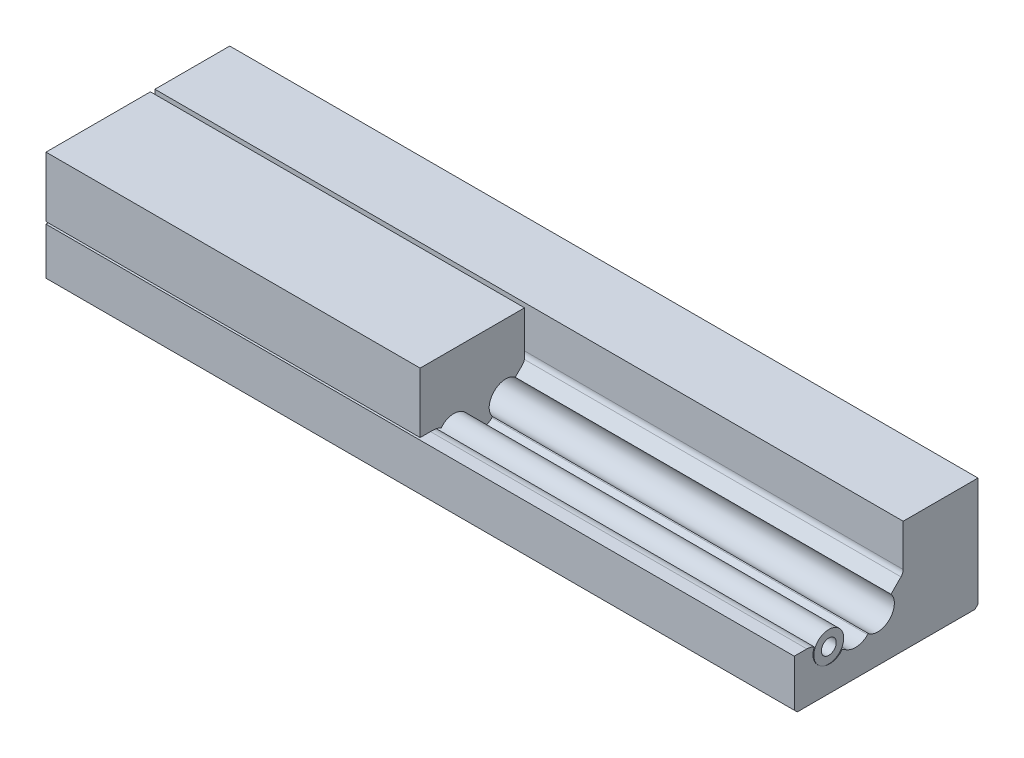
from build123d import *

# Parameters (mm, degrees)
BOSS_EXTRUDE1_DEPTH = 100
BOSS_EXTRUDE2_DEPTH = 50
SKETCH1_4_R         = 2
SKETCH1_4_R_2       = 1
BOSS_EXTRUDE3_DEPTH = 100


with BuildPart() as part:
    # Sketch1 → Boss-Extrude1 (new body)
    with BuildSketch(Plane.YZ):
        with BuildLine():
            Line((-14.6, 0), (0, 0))
            Line((0, 0), (0, 10))
            Line((0, 10), (-5.585786438, 10))
            ThreePointArc((-5.585786438, 10), (-5.96846987, 10.076120467), (-6.292893219, 10.292893219))
            Line((-6.292893219, 10.292893219), (-7.630448846, 11.630448846))
            add(Edge.make_bspline(
                [(-10.662444373, 14.662444373), (-11.864824632, 13.248529542), (-10.454594155, 11.838299064), (-9.044363677, 10.428068587), (-7.630448846, 11.630448846)],
                knots=[0.075070491, 0.075070491, 0.075070491, 1.570796327, 1.570796327, 3.066522163, 3.066522163, 3.066522163], degree=2, weights=[1, 0.733143915, 1, 0.733143915, 1]))
            Line((-10.662444373, 14.662444373), (-10.752061132, 14.752061132))
            Line((-10.752061132, 14.752061132), (-12, 16))
            Line((-12, 16), (-11.117573964, 17.528406729))
            Line((-11.117573964, 17.528406729), (-10.75254502, 18.160655405))
            add(Edge.make_bspline(
                [(-11.282719811, 20.942365731), (-12.279903121, 19.215193255), (-10.75254502, 18.160655405)],
                knots=[1.570796412, 1.570796412, 1.570796412, 3.066522163, 3.066522163, 3.066522163], degree=2, weights=[1, 0.733143944, 1]))
            add(Edge.make_bspline(
                [(-8.608600423, 21.874076377), (-10.285536329, 22.669538504), (-11.282719811, 20.942365731)],
                knots=[0.075070491, 0.075070491, 0.075070491, 1.570796412, 1.570796412, 1.570796412], degree=2, weights=[1, 0.733143886, 1]))
            ThreePointArc((-8.608600423, 21.874076377), (-8.408799578, 22.356438286), (-8.34065123, 22.874076377))
            Line((-8.34065123, 22.874076377), (-8.34065123, 24.555864176))
            Line((-8.34065123, 24.555864176), (-14.6, 24.555864176))
            Line((-14.6, 24.555864176), (-15, 24.155864176))
            Line((-15, 24.155864176), (-15, 0.4))
            Line((-15, 0.4), (-14.6, 0))
        make_face()
        with BuildLine():
            Line((-12, 16), (-10.752061132, 14.752061132))
            ThreePointArc((-10.752061132, 14.752061132), (-11.406038716, 16.078196486), (-11.117573964, 17.528406729))
            Line((-11.117573964, 17.528406729), (-12, 16))
        make_face()
    extrude(amount=BOSS_EXTRUDE1_DEPTH)


with BuildPart() as body_2:
    # Sketch1<3> → Boss-Extrude2 (new body)
    with BuildSketch(Plane.YZ):
        with BuildLine():
            add(Edge.make_bspline(
                [(-7.418316812, 11.84258088), (-6.215936552, 13.256495711), (-7.62616703, 14.666726189), (-9.036397507, 16.076956667), (-10.450312338, 14.874576407)],
                knots=[3.216663145, 3.216663145, 3.216663145, 4.71238898, 4.71238898, 6.208114816, 6.208114816, 6.208114816], degree=2, weights=[1, 0.733143915, 1, 0.733143915, 1]))
            Line((-7.418316812, 11.84258088), (-6.46862915, 10.892893219))
            ThreePointArc((-6.46862915, 10.892893219), (-6.144205801, 10.676120467), (-5.761522369, 10.6))
            Line((-5.761522369, 10.6), (0, 10.6))
            Line((0, 10.6), (0, 24.555864176))
            Line((0, 24.555864176), (-7.060269515, 24.555864176))
            Line((-7.060269515, 24.555864176), (-8.04065123, 24.555864176))
            Line((-8.04065123, 24.555864176), (-8.04065123, 22.874076377))
            ThreePointArc((-8.04065123, 22.874076377), (-8.11902183, 22.278792573), (-8.348792802, 21.724076377))
            add(Edge.make_bspline(
                [(-7.818617405, 18.9423671), (-6.821435564, 20.669539122), (-8.348792802, 21.724076377)],
                knots=[4.71238963, 4.71238963, 4.71238963, 6.208114816, 6.208114816, 6.208114816], degree=2, weights=[1, 0.733144136, 1]))
            add(Edge.make_bspline(
                [(-10.492737399, 18.010655405), (-8.815800545, 17.215192828), (-7.818617405, 18.9423671)],
                knots=[3.216663145, 3.216663145, 3.216663145, 4.71238963, 4.71238963, 4.71238963], degree=2, weights=[1, 0.733143694, 1]))
            Line((-10.492737399, 18.010655405), (-10.857766343, 17.378406729))
            ThreePointArc((-10.857766343, 17.378406729), (-11.108605258, 16.117354344), (-10.539929097, 14.964193166))
            Line((-10.539929097, 14.964193166), (-10.450312338, 14.874576407))
        make_face()
    extrude(amount=BOSS_EXTRUDE2_DEPTH)


with BuildPart() as body_3:
    # Sketch1<4> → Boss-Extrude3 (new body)
    with BuildSketch(Plane.YZ):
        with Locations(Location((-9.550668911, 19.942365891, 0), (0, 0, 90))):
            Circle(SKETCH1_4_R)
        with Locations(Location((-9.550668911, 19.942365891, 0), (0, 0, 90))):
            Circle(SKETCH1_4_R_2, mode=Mode.SUBTRACT)
    extrude(amount=BOSS_EXTRUDE3_DEPTH)


solid = Compound([part.part, body_2.part, body_3.part])
